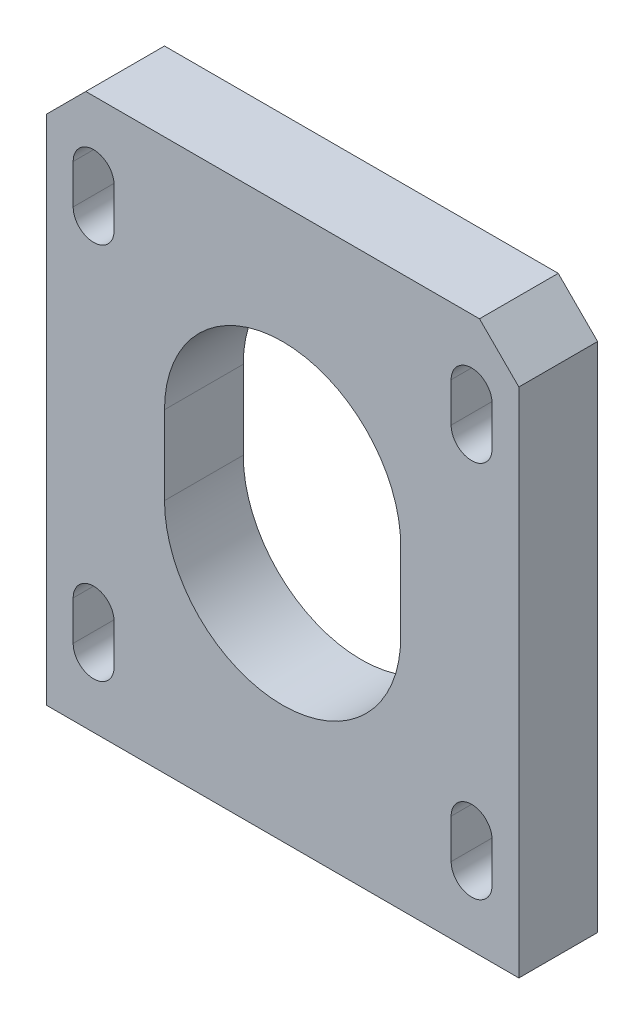
from build123d import *

# Parameters (mm, degrees)
ESQUISSE1_W             = 60
ESQUISSE1_H             = 70
BOSS_EXTRU_1_DEPTH      = 10
ENL_V_MAT_EXTRU_1_DEPTH = 10
CHANFREIN1_SIZE         = 5


with BuildPart() as part:
    # Esquisse1 → Boss.-Extru.1 (new body)
    with BuildSketch(Plane.XY):
        with Locations((30, 35)):
            Rectangle(ESQUISSE1_W, ESQUISSE1_H)
    extrude(amount=BOSS_EXTRU_1_DEPTH)

    # Esquisse2 → Enlèv. mat.-Extru.1 (cut)
    with BuildSketch(Plane.XY.offset(10)):
        with BuildLine():
            Line((8.6, 61.5), (8.6, 56.5))
            ThreePointArc((8.6, 56.5), (6, 53.9), (3.4, 56.5))
            Line((3.4, 56.5), (3.4, 61.5))
            ThreePointArc((3.4, 61.5), (6, 64.1), (8.6, 61.5))
        make_face()
        with BuildLine():
            Line((51.4, 61.5), (51.4, 56.5))
            ThreePointArc((51.4, 56.5), (54, 53.9), (56.6, 56.5))
            Line((56.6, 56.5), (56.6, 61.5))
            ThreePointArc((56.6, 61.5), (54, 64.1), (51.4, 61.5))
        make_face()
        with BuildLine():
            Line((51.4, 8.5), (51.4, 13.5))
            ThreePointArc((51.4, 13.5), (54, 16.1), (56.6, 13.5))
            Line((56.6, 13.5), (56.6, 8.5))
            ThreePointArc((56.6, 8.5), (54, 5.9), (51.4, 8.5))
        make_face()
        with BuildLine():
            Line((8.6, 8.5), (8.6, 13.5))
            ThreePointArc((8.6, 13.5), (6, 16.1), (3.4, 13.5))
            Line((3.4, 13.5), (3.4, 8.5))
            ThreePointArc((3.4, 8.5), (6, 5.9), (8.6, 8.5))
        make_face()
        with BuildLine():
            Line((15, 30), (15, 40))
            ThreePointArc((15, 40), (30, 55), (45, 40))
            Line((45, 40), (45, 30))
            ThreePointArc((45, 30), (30, 15), (15, 30))
        make_face()
    extrude(amount=-ENL_V_MAT_EXTRU_1_DEPTH, mode=Mode.SUBTRACT)

    # Chanfrein1
    chanfrein1_edges = [part.edges().sort_by_distance(p)[0] for p in [
        (0, 70, 5),
        (60, 70, 5),
    ]]
    chamfer(chanfrein1_edges, length=CHANFREIN1_SIZE)


solid = part.part
